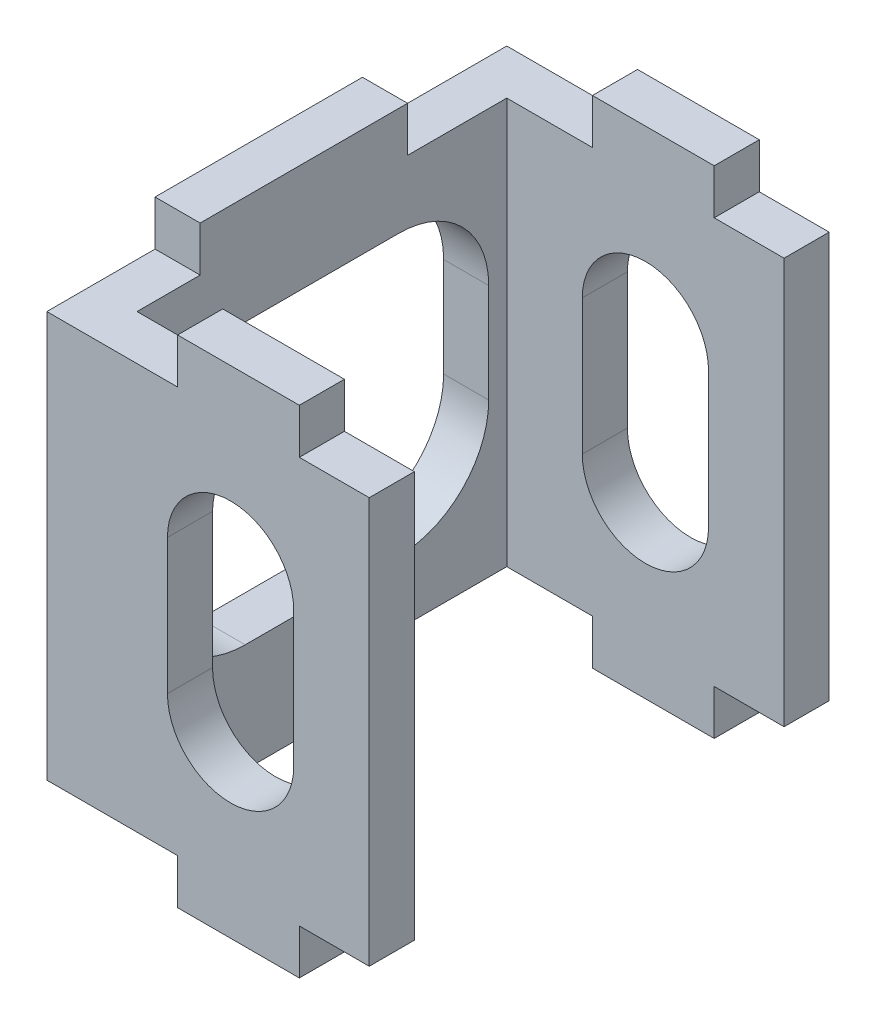
from build123d import *

# Parameters (mm, degrees)
ESQUISSE1_W                  = 52.5
ESQUISSE1_H                  = 57.5
ESQUISSE1_W_2                = 42.5
ESQUISSE1_H_2                = 47.5
EXTRU_MINCE1_DEPTH           = 20
ESQUISSE3_W                  = 6.75
ESQUISSE3_H                  = 41
ESQUISSE3_W_2                = 30.75
BOSS_EXTRU_1_DEPTH           = 45
ESQUISSE6_W                  = 5
ESQUISSE6_H                  = 23
ESQUISSE6_W_2                = 13.5
ESQUISSE6_H_2                = 5
BOSS_EXTRU_3_DEPTH           = 5
ENL_V_MAT_EXTRU_1_REACH      = 100.236
ESQUISSE2_R                  = 1.6
ENL_V_START                  = -3
ENL_V_MAT_EXTRU_2_DEPTH      = 3
CONG_1_R                     = 3
ENL_V_MAT_EXTRU_3_DEPTH      = 116.440731547
ENL_V_MAT_EXTRU_4_DEPTH      = 95.578010129
ENL_V_MAT_EXTRU_5_DEPTH      = 85.679173945
ENL_V_MAT_EXTRU_5_DEPTH_BACK = 85.679173945
ESQUISSE11_W                 = 64.25
ESQUISSE11_H                 = 72.384582196


with BuildPart() as part:
    # Esquisse1 → Extru.-Mince1 (new body)
    with BuildSketch(Plane(origin=(0, 0, 0), x_dir=(1, 0, 0), z_dir=(0, 1, 0))):
        Rectangle(ESQUISSE1_W, ESQUISSE1_H)
        Rectangle(ESQUISSE1_W_2, ESQUISSE1_H_2, mode=Mode.SUBTRACT)
    extrude(amount=EXTRU_MINCE1_DEPTH)

    # Esquisse3 → Boss.-Extru.1 (add)
    with BuildSketch(Plane.XZ):
        Polygon((26.25, 28.75), (38, 28.75), (38, -22.25), (21.25, -22.25), (21.25, 23.75), (-21.25, 23.75), (-21.25, -22.25), (-62, -22.25), (-62, 28.75), (-26.25, 28.75), (0, 28.75), align=None)
        with Locations((29.625, 3.25)):
            Rectangle(ESQUISSE3_W, ESQUISSE3_H, mode=Mode.SUBTRACT)
        with Locations((-41.625, 3.25)):
            Rectangle(ESQUISSE3_W_2, ESQUISSE3_H, mode=Mode.SUBTRACT)
    extrude(amount=-BOSS_EXTRU_1_DEPTH)

    # Esquisse6 → Boss.-Extru.3 (add)
    with BuildSketch(Plane(origin=(0, 45, 0), x_dir=(1, 0, 0), z_dir=(0, 1, 0))):
        with Locations((35.5, -5.25)):
            Rectangle(ESQUISSE6_W, ESQUISSE6_H)
        with Locations((16.25, -26.25)):
            Rectangle(ESQUISSE6_W_2, ESQUISSE6_H_2)
        with Locations((-12.25, -26.25)):
            Rectangle(ESQUISSE6_W_2, ESQUISSE6_H_2)
        with Locations((-40.75, -26.25)):
            Rectangle(ESQUISSE6_W_2, ESQUISSE6_H_2)
        with Locations((-40.75, 19.75)):
            Rectangle(ESQUISSE6_W_2, ESQUISSE6_H_2)
        with Locations((-59.5, -5.25)):
            Rectangle(ESQUISSE6_W, ESQUISSE6_H)
    boss_extru_3 = extrude(amount=BOSS_EXTRU_3_DEPTH)

    # Esquisse2 → Enlèv. mat.-Extru.1 (cut, up to next)
    with BuildSketch(Plane.XY.offset(28.75), mode=Mode.PRIVATE) as enl_v_mat_extru_1_sk1:
        with Locations((-15.5, 5.2)):
            Circle(ESQUISSE2_R)
    enl_v_mat_extru_1_tool1 = extrude(enl_v_mat_extru_1_sk1.sketch, amount=-ENL_V_MAT_EXTRU_1_REACH, mode=Mode.PRIVATE) & part.part
    # Esquisse2 → Enlèv. mat.-Extru.1 (cut, up to next)
    with BuildSketch(Plane.XY.offset(28.75), mode=Mode.PRIVATE) as enl_v_mat_extru_1_sk2:
        with Locations((15.5, 5.2)):
            Circle(ESQUISSE2_R)
    enl_v_mat_extru_1_tool2 = extrude(enl_v_mat_extru_1_sk2.sketch, amount=-ENL_V_MAT_EXTRU_1_REACH, mode=Mode.PRIVATE) & part.part
    # Esquisse2 → Enlèv. mat.-Extru.1 (cut, up to next)
    with BuildSketch(Plane.XY.offset(28.75), mode=Mode.PRIVATE) as enl_v_mat_extru_1_sk3:
        with Locations(Location((15.5, 34.8, 0), (0, 0, 180))):
            Circle(ESQUISSE2_R)
    enl_v_mat_extru_1_tool3 = extrude(enl_v_mat_extru_1_sk3.sketch, amount=-ENL_V_MAT_EXTRU_1_REACH, mode=Mode.PRIVATE) & part.part
    # Esquisse2 → Enlèv. mat.-Extru.1 (cut, up to next)
    with BuildSketch(Plane.XY.offset(28.75), mode=Mode.PRIVATE) as enl_v_mat_extru_1_sk4:
        with Locations(Location((-15.5, 34.8, 0), (0, 0, 180))):
            Circle(ESQUISSE2_R)
    enl_v_mat_extru_1_tool4 = extrude(enl_v_mat_extru_1_sk4.sketch, amount=-ENL_V_MAT_EXTRU_1_REACH, mode=Mode.PRIVATE) & part.part
    # Esquisse2 → Enlèv. mat.-Extru.1 (cut, up to next)
    with BuildSketch(Plane.XY.offset(28.75), mode=Mode.PRIVATE) as enl_v_mat_extru_1_sk5:
        with BuildLine():
            Line((2.65, 36.215870824), (2.65, 32.215870824))
            ThreePointArc((2.65, 32.215870824), (0, 7.5), (-2.65, 32.215870824))
            Line((-2.65, 32.215870824), (-2.65, 36.215870824))
            ThreePointArc((-2.65, 36.215870824), (0, 38.865870824), (2.65, 36.215870824))
        make_face()
    enl_v_mat_extru_1_tool5 = extrude(enl_v_mat_extru_1_sk5.sketch, amount=-ENL_V_MAT_EXTRU_1_REACH, mode=Mode.PRIVATE) & part.part
    add(enl_v_mat_extru_1_tool1.solids().sort_by_distance((-15.5, 5.2, 28.75))[0], mode=Mode.SUBTRACT)
    add(enl_v_mat_extru_1_tool2.solids().sort_by_distance((15.5, 5.2, 28.75))[0], mode=Mode.SUBTRACT)
    add(enl_v_mat_extru_1_tool3.solids().sort_by_distance((15.5, 34.8, 28.75))[0], mode=Mode.SUBTRACT)
    add(enl_v_mat_extru_1_tool4.solids().sort_by_distance((-15.5, 34.8, 28.75))[0], mode=Mode.SUBTRACT)
    add(enl_v_mat_extru_1_tool5.solids().sort_by_distance((0, 20.91985, 28.75))[0], mode=Mode.SUBTRACT)

    # Esquisse4 → Enlèv. mat.-Extru.2 (cut)
    with BuildSketch(Plane(origin=(0, 0, 23.75), x_dir=(-1, 0, 0), z_dir=(0, 0, -1)).offset(ENL_V_START)):
        with BuildLine():
            Line((-12.5, 20), (-12.5, 50))
            Line((-12.5, 50), (12.5, 50))
            Line((12.5, 50), (12.5, 20))
            ThreePointArc((12.5, 20), (0, 32.5), (-12.5, 20))
        make_face()
    extrude(amount=ENL_V_MAT_EXTRU_2_DEPTH, mode=Mode.SUBTRACT)

    # Symétrie1: Boss.-Extru.3 across plane
    add(boss_extru_3.mirror(Plane(origin=(0, 22.5, 0), x_dir=(0, 0, 1), z_dir=(0, -1, 0))))

    # Congé1
    cong_1_edges = [part.edges().sort_by_distance(p)[0] for p in [
        (0, 20, -23.75),
    ]]
    fillet(cong_1_edges, radius=CONG_1_R)

    # Esquisse7 → Enlèv. mat.-Extru.3 (cut, through all)
    with BuildSketch(Plane(origin=(38, 0, 0), x_dir=(0, 0, -1), z_dir=(1, 0, 0))):
        with BuildLine():
            Line((-11.75, 38), (5.25, 38))
            ThreePointArc((5.25, 38), (12.321067812, 35.071067812), (15.25, 28))
            Line((15.25, 28), (15.25, 17))
            ThreePointArc((15.25, 17), (12.321067812, 9.928932188), (5.25, 7))
            Line((5.25, 7), (-11.75, 7))
            ThreePointArc((-11.75, 7), (-18.821067812, 9.928932188), (-21.75, 17))
            Line((-21.75, 17), (-21.75, 28))
            ThreePointArc((-21.75, 28), (-18.821067812, 35.071067812), (-11.75, 38))
        make_face()
    extrude(amount=-ENL_V_MAT_EXTRU_3_DEPTH, mode=Mode.SUBTRACT)

    # Esquisse8 → Enlèv. mat.-Extru.4 (cut, through all)
    with BuildSketch(Plane(origin=(0, 0, -22.25), x_dir=(-1, 0, 0), z_dir=(0, 0, -1))):
        with BuildLine():
            Line((48.625, 30), (48.625, 15))
            ThreePointArc((48.625, 15), (41.625, 8), (34.625, 15))
            Line((34.625, 15), (34.625, 30))
            ThreePointArc((34.625, 30), (41.625, 37), (48.625, 30))
        make_face()
    extrude(amount=-ENL_V_MAT_EXTRU_4_DEPTH, mode=Mode.SUBTRACT)

    # Esquisse11 → Enlèv. mat.-Extru.5 (cut, two sides: drawn at the far end of the back side and taken through both)
    with BuildSketch(Plane(origin=(0, 45, 0), x_dir=(1, 0, 0), z_dir=(0, 1, 0)).offset(-ENL_V_MAT_EXTRU_5_DEPTH_BACK)):
        with Locations((5.875, 7.442291098)):
            Rectangle(ESQUISSE11_W, ESQUISSE11_H)
    extrude(amount=ENL_V_MAT_EXTRU_5_DEPTH + ENL_V_MAT_EXTRU_5_DEPTH_BACK, mode=Mode.SUBTRACT)


solid = part.part
